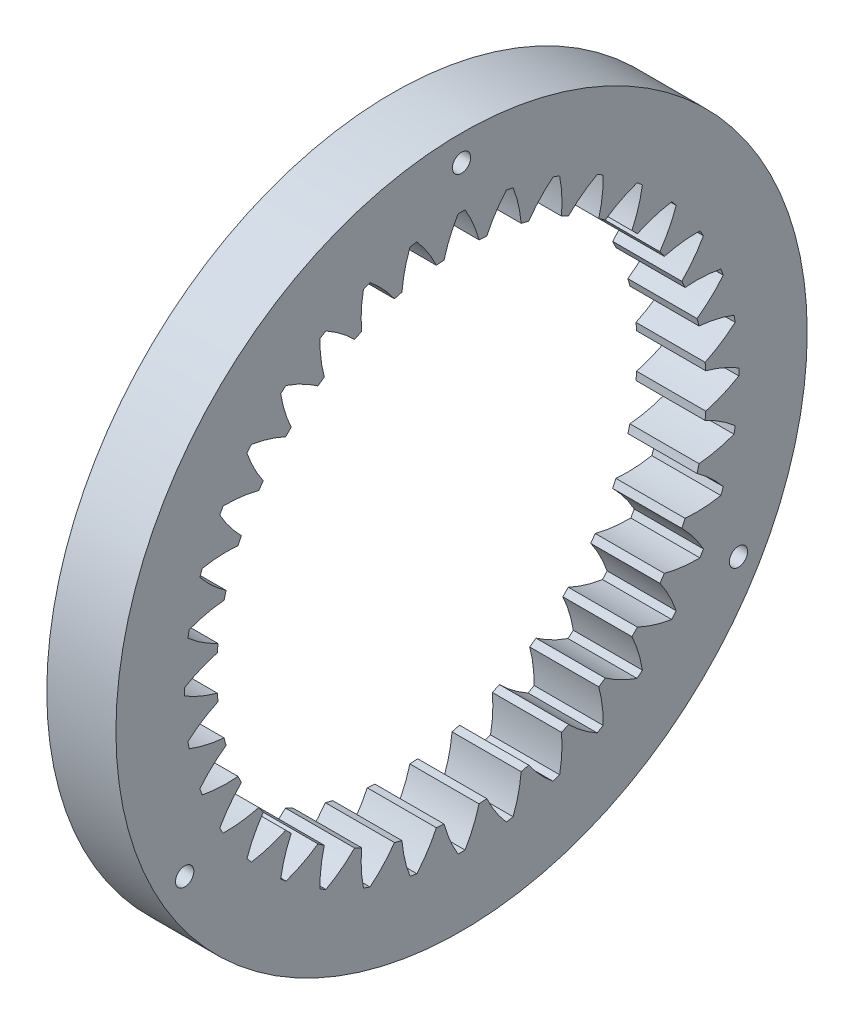
from build123d import *

# Parameters (mm, degrees)
BASPROSKE_W           = 12
BASPROSKE_H           = 17.5
TOOTHCUT_DEPTH        = 86.697141143
TEETHCUTS_COUNT       = 36
TEETHCUTS_ANGLE       = 350
CROQUIS1_R            = 1.5875
CORTAR_EXTRUIR1_DEPTH = 86.697141143


with BuildPart() as part:
    # BasProSke → Base-Revolve (revolve)
    with BuildSketch(Plane(origin=(0, 0, 0), x_dir=(1, 0, 0), z_dir=(0, 1, 0)), mode=Mode.PRIVATE) as base_revolve_sk:
        with Locations((6, 51.25)):
            Rectangle(BASPROSKE_W, BASPROSKE_H)
    revolve(base_revolve_sk.sketch.rotate(Axis((-10, 0, 0), (1, 0, 0)), 180), axis=Axis((-10, 0, 0), (1, 0, 0)))

    # TooCutSke → ToothCut (cut, through all)
    with BuildSketch(Plane(origin=(0, 0, 0), x_dir=(0, 0, -1), z_dir=(1, 0, 0))):
        with BuildLine():
            ThreePointArc((3.039162779, 42.365730665), (2.023087834, 45.328879437), (0.605322624, 48.122193014))
            ThreePointArc((0.605322624, 48.122193014), (0, 48.126), (-0.605322624, 48.122193014))
            ThreePointArc((-0.605322624, 48.122193014), (-2.023087834, 45.328879437), (-3.039162779, 42.365730665))
            ThreePointArc((-3.039162779, 42.365730665), (0, 42.4746), (3.039162779, 42.365730665))
        make_face()
    toothcut = extrude(amount=TOOTHCUT_DEPTH, mode=Mode.SUBTRACT)

    # TeethCuts: ToothCut ×36 about axis
    teethcuts_axis = Axis((-10, 0, 0), (1, 0, 0))
    for i in range(1, TEETHCUTS_COUNT):
        add(toothcut.rotate(teethcuts_axis, i * TEETHCUTS_ANGLE / (TEETHCUTS_COUNT - 1)), mode=Mode.SUBTRACT)

    # Croquis1 → Cortar-Extruir1 (cut, through all)
    with BuildSketch(Plane(origin=(12, 0, 0), x_dir=(0, 0, -1), z_dir=(1, 0, 0))):
        with Locations((0, 55.5)):
            Circle(CROQUIS1_R)
        with Locations((48.06440991, -27.75)):
            Circle(CROQUIS1_R)
        with Locations((-48.06440991, -27.75)):
            Circle(CROQUIS1_R)
    extrude(amount=-CORTAR_EXTRUIR1_DEPTH, mode=Mode.SUBTRACT)


solid = part.part
